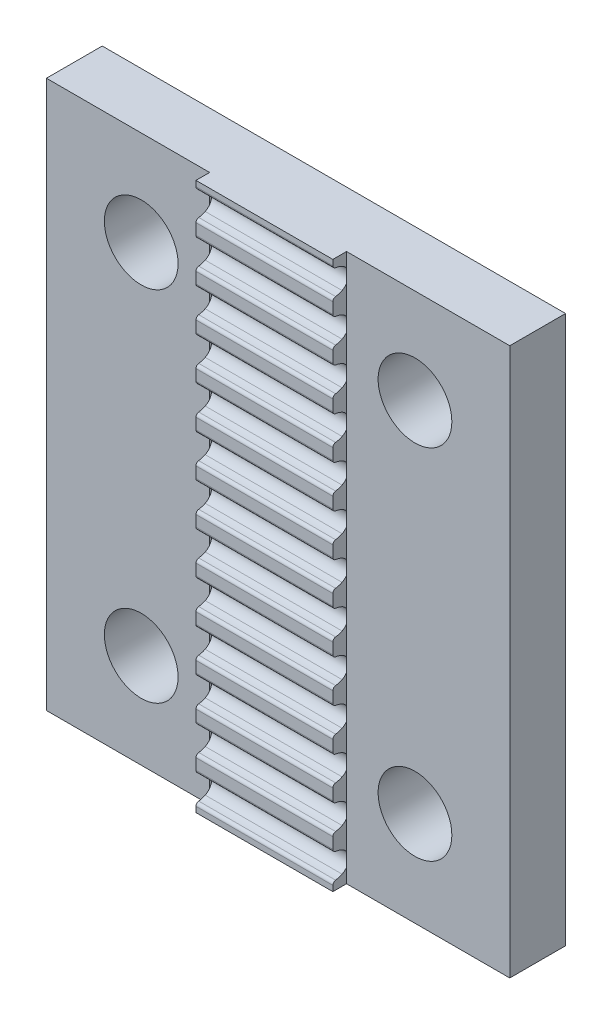
from build123d import *

# Parameters (mm, degrees)
SCHIZZO1_W                   = 7.75
SCHIZZO1_H                   = 26
SCHIZZO1_R                   = 1.75
SCHIZZO1_W_2                 = 6.5
ESTRUSIONE_ESTRUSIONE1_DEPTH = 1
SCHIZZO1_3_W                 = 6.5
SCHIZZO1_3_H                 = 26
ESTRUSIONE_ESTRUSIONE2_DEPTH = 1.65
ESTRUSIONE_ESTRUSIONE3_START = -1.65
SCHIZZO1_5_W                 = 7.75
SCHIZZO1_5_H                 = 26
SCHIZZO1_5_R                 = 1.75
SCHIZZO1_5_W_2               = 6.5
ESTRUSIONE_ESTRUSIONE3_DEPTH = 1.65
TAGLIO_ESTRUSIONE1_DEPTH     = 6.5


with BuildPart() as part:
    # Schizzo1 → Estrusione-Estrusione1 (new body)
    # profile 1 of 3: a face of its own
    with BuildSketch(Plane.XY):
        with Locations((-7.125, 0)):
            Rectangle(SCHIZZO1_W, SCHIZZO1_H)
        with Locations((-6.5, -8.5)):
            Circle(SCHIZZO1_R, mode=Mode.SUBTRACT)
        with Locations((-6.5, 8.5)):
            Circle(SCHIZZO1_R, mode=Mode.SUBTRACT)
    # profile 2 of 3: a face of its own
    with BuildSketch(Plane.XY):
        Rectangle(SCHIZZO1_W_2, SCHIZZO1_H)
    # profile 3 of 3: a face of its own
    with BuildSketch(Plane.XY):
        with Locations((7.125, 0)):
            Rectangle(SCHIZZO1_W, SCHIZZO1_H)
        with Locations((6.5, -8.5)):
            Circle(SCHIZZO1_R, mode=Mode.SUBTRACT)
        with Locations((6.5, 8.5)):
            Circle(SCHIZZO1_R, mode=Mode.SUBTRACT)
    extrude(amount=ESTRUSIONE_ESTRUSIONE1_DEPTH)

    # Schizzo1<3> → Estrusione-Estrusione2 (add)
    with BuildSketch(Plane.XY):
        Rectangle(SCHIZZO1_3_W, SCHIZZO1_3_H)
    extrude(amount=ESTRUSIONE_ESTRUSIONE2_DEPTH)

    # Schizzo1<5> → Estrusione-Estrusione3 (add)
    # profile 1 of 3: a face of its own
    with BuildSketch(Plane.XY.offset(ESTRUSIONE_ESTRUSIONE3_START)):
        with Locations((-7.125, 0)):
            Rectangle(SCHIZZO1_5_W, SCHIZZO1_5_H)
        with Locations((-6.5, -8.5)):
            Circle(SCHIZZO1_5_R, mode=Mode.SUBTRACT)
        with Locations((-6.5, 8.5)):
            Circle(SCHIZZO1_5_R, mode=Mode.SUBTRACT)
    # profile 2 of 3: a face of its own
    with BuildSketch(Plane.XY.offset(ESTRUSIONE_ESTRUSIONE3_START)):
        Rectangle(SCHIZZO1_5_W_2, SCHIZZO1_5_H)
    # profile 3 of 3: a face of its own
    with BuildSketch(Plane.XY.offset(ESTRUSIONE_ESTRUSIONE3_START)):
        with Locations((7.125, 0)):
            Rectangle(SCHIZZO1_5_W, SCHIZZO1_5_H)
        with Locations((6.5, -8.5)):
            Circle(SCHIZZO1_5_R, mode=Mode.SUBTRACT)
        with Locations((6.5, 8.5)):
            Circle(SCHIZZO1_5_R, mode=Mode.SUBTRACT)
    extrude(amount=ESTRUSIONE_ESTRUSIONE3_DEPTH)

    # Schizzo2 → Taglio-Estrusione1 (cut)
    with BuildSketch(Plane.ZY.offset(3.25)):
        with BuildLine():
            Line((1.65, 13), (1.65, 12.740175425))
            ThreePointArc((1.65, 12.740175425), (1.612771412, 12.641268354), (1.519565217, 12.591456891))
            ThreePointArc((1.519565217, 12.591456891), (1.361937846, 12.557611714), (1.211797753, 12.498876404))
            ThreePointArc((1.211797753, 12.498876404), (0.9, 12), (1.211797753, 11.501123596))
            ThreePointArc((1.211797753, 11.501123596), (1.361937846, 11.442388286), (1.519565217, 11.408543109))
            ThreePointArc((1.519565217, 11.408543109), (1.612771412, 11.358731646), (1.65, 11.259824575))
            Line((1.65, 11.259824575), (1.65, 11))
            Line((1.65, 11), (1.65, 10.740175425))
            ThreePointArc((1.65, 10.740175425), (1.612771412, 10.641268354), (1.519565217, 10.591456891))
            ThreePointArc((1.519565217, 10.591456891), (1.361937846, 10.557611714), (1.211797753, 10.498876404))
            ThreePointArc((1.211797753, 10.498876404), (0.9, 10), (1.211797753, 9.501123596))
            ThreePointArc((1.211797753, 9.501123596), (1.361937846, 9.442388286), (1.519565217, 9.408543109))
            ThreePointArc((1.519565217, 9.408543109), (1.612771412, 9.358731646), (1.65, 9.259824575))
            Line((1.65, 9.259824575), (1.65, 9))
            Line((1.65, 9), (1.65, 8.740175425))
            ThreePointArc((1.65, 8.740175425), (1.612771412, 8.641268354), (1.519565217, 8.591456891))
            ThreePointArc((1.519565217, 8.591456891), (1.361937846, 8.557611714), (1.211797753, 8.498876404))
            ThreePointArc((1.211797753, 8.498876404), (0.9, 8), (1.211797753, 7.501123596))
            ThreePointArc((1.211797753, 7.501123596), (1.361937846, 7.442388286), (1.519565217, 7.408543109))
            ThreePointArc((1.519565217, 7.408543109), (1.612771412, 7.358731646), (1.65, 7.259824575))
            Line((1.65, 7.259824575), (1.65, 7))
            Line((1.65, 7), (1.65, 6.740175425))
            ThreePointArc((1.65, 6.740175425), (1.612771412, 6.641268354), (1.519565217, 6.591456891))
            ThreePointArc((1.519565217, 6.591456891), (1.361937846, 6.557611714), (1.211797753, 6.498876404))
            ThreePointArc((1.211797753, 6.498876404), (0.9, 6), (1.211797753, 5.501123596))
            ThreePointArc((1.211797753, 5.501123596), (1.361937846, 5.442388286), (1.519565217, 5.408543109))
            ThreePointArc((1.519565217, 5.408543109), (1.612771412, 5.358731646), (1.65, 5.259824575))
            Line((1.65, 5.259824575), (1.65, 5))
            Line((1.65, 5), (1.65, 4.740175425))
            ThreePointArc((1.65, 4.740175425), (1.612771412, 4.641268354), (1.519565217, 4.591456891))
            ThreePointArc((1.519565217, 4.591456891), (1.361937846, 4.557611714), (1.211797753, 4.498876404))
            ThreePointArc((1.211797753, 4.498876404), (0.9, 4), (1.211797753, 3.501123596))
            ThreePointArc((1.211797753, 3.501123596), (1.361937846, 3.442388286), (1.519565217, 3.408543109))
            ThreePointArc((1.519565217, 3.408543109), (1.612771412, 3.358731646), (1.65, 3.259824575))
            Line((1.65, 3.259824575), (1.65, 3))
            Line((1.65, 3), (1.65, 2.740175425))
            ThreePointArc((1.65, 2.740175425), (1.612771412, 2.641268354), (1.519565217, 2.591456891))
            ThreePointArc((1.519565217, 2.591456891), (1.361937846, 2.557611714), (1.211797753, 2.498876404))
            ThreePointArc((1.211797753, 2.498876404), (0.9, 2), (1.211797753, 1.501123596))
            ThreePointArc((1.211797753, 1.501123596), (1.361937846, 1.442388286), (1.519565217, 1.408543109))
            ThreePointArc((1.519565217, 1.408543109), (1.612771412, 1.358731646), (1.65, 1.259824575))
            Line((1.65, 1.259824575), (1.65, 1))
            Line((1.65, 1), (1.65, 0.740175425))
            ThreePointArc((1.65, 0.740175425), (1.612771412, 0.641268354), (1.519565217, 0.591456891))
            ThreePointArc((1.519565217, 0.591456891), (1.361937846, 0.557611714), (1.211797753, 0.498876404))
            ThreePointArc((1.211797753, 0.498876404), (0.9, 0), (1.211797753, -0.498876404))
            ThreePointArc((1.211797753, -0.498876404), (1.361937846, -0.557611714), (1.519565217, -0.591456891))
            ThreePointArc((1.519565217, -0.591456891), (1.612771412, -0.641268354), (1.65, -0.740175425))
            Line((1.65, -0.740175425), (1.65, -1))
            Line((1.65, -1), (1.65, -1.259824575))
            ThreePointArc((1.65, -1.259824575), (1.612771412, -1.358731646), (1.519565217, -1.408543109))
            ThreePointArc((1.519565217, -1.408543109), (1.361937846, -1.442388286), (1.211797753, -1.501123596))
            ThreePointArc((1.211797753, -1.501123596), (0.9, -2), (1.211797753, -2.498876404))
            ThreePointArc((1.211797753, -2.498876404), (1.361937846, -2.557611714), (1.519565217, -2.591456891))
            ThreePointArc((1.519565217, -2.591456891), (1.612771412, -2.641268354), (1.65, -2.740175425))
            Line((1.65, -2.740175425), (1.65, -3))
            Line((1.65, -3), (1.65, -3.259824575))
            ThreePointArc((1.65, -3.259824575), (1.612771412, -3.358731646), (1.519565217, -3.408543109))
            ThreePointArc((1.519565217, -3.408543109), (1.361937846, -3.442388286), (1.211797753, -3.501123596))
            ThreePointArc((1.211797753, -3.501123596), (0.9, -4), (1.211797753, -4.498876404))
            ThreePointArc((1.211797753, -4.498876404), (1.361937846, -4.557611714), (1.519565217, -4.591456891))
            ThreePointArc((1.519565217, -4.591456891), (1.612771412, -4.641268354), (1.65, -4.740175425))
            Line((1.65, -4.740175425), (1.65, -5))
            Line((1.65, -5), (1.65, -5.259824575))
            ThreePointArc((1.65, -5.259824575), (1.612771412, -5.358731646), (1.519565217, -5.408543109))
            ThreePointArc((1.519565217, -5.408543109), (1.361937846, -5.442388286), (1.211797753, -5.501123596))
            ThreePointArc((1.211797753, -5.501123596), (0.9, -6), (1.211797753, -6.498876404))
            ThreePointArc((1.211797753, -6.498876404), (1.361937846, -6.557611714), (1.519565217, -6.591456891))
            ThreePointArc((1.519565217, -6.591456891), (1.612771412, -6.641268354), (1.65, -6.740175425))
            Line((1.65, -6.740175425), (1.65, -7))
            Line((1.65, -7), (1.65, -7.259824575))
            ThreePointArc((1.65, -7.259824575), (1.612771412, -7.358731646), (1.519565217, -7.408543109))
            ThreePointArc((1.519565217, -7.408543109), (1.361937846, -7.442388286), (1.211797753, -7.501123596))
            ThreePointArc((1.211797753, -7.501123596), (0.9, -8), (1.211797753, -8.498876404))
            ThreePointArc((1.211797753, -8.498876404), (1.361937846, -8.557611714), (1.519565217, -8.591456891))
            ThreePointArc((1.519565217, -8.591456891), (1.612771412, -8.641268354), (1.65, -8.740175425))
            Line((1.65, -8.740175425), (1.65, -9))
            Line((1.65, -9), (1.65, -9.259824575))
            ThreePointArc((1.65, -9.259824575), (1.612771412, -9.358731646), (1.519565217, -9.408543109))
            ThreePointArc((1.519565217, -9.408543109), (1.361937846, -9.442388286), (1.211797753, -9.501123596))
            ThreePointArc((1.211797753, -9.501123596), (0.9, -10), (1.211797753, -10.498876404))
            ThreePointArc((1.211797753, -10.498876404), (1.361937846, -10.557611714), (1.519565217, -10.591456891))
            ThreePointArc((1.519565217, -10.591456891), (1.612771412, -10.641268354), (1.65, -10.740175425))
            Line((1.65, -10.740175425), (1.65, -11))
            Line((1.65, -11), (1.65, -11.259824575))
            ThreePointArc((1.65, -11.259824575), (1.612771412, -11.358731646), (1.519565217, -11.408543109))
            ThreePointArc((1.519565217, -11.408543109), (1.361937846, -11.442388286), (1.211797753, -11.501123596))
            ThreePointArc((1.211797753, -11.501123596), (0.9, -12), (1.211797753, -12.498876404))
            ThreePointArc((1.211797753, -12.498876404), (1.361937846, -12.557611714), (1.519565217, -12.591456891))
            ThreePointArc((1.519565217, -12.591456891), (1.612771412, -12.641268354), (1.65, -12.740175425))
            Line((1.65, -12.740175425), (1.65, -13))
            Line((1.65, -13), (2.28, -13))
            Line((2.28, -13), (2.28, -11))
            Line((2.28, -11), (2.28, -9))
            Line((2.28, -9), (2.28, -7))
            Line((2.28, -7), (2.28, -5))
            Line((2.28, -5), (2.28, -3))
            Line((2.28, -3), (2.28, -1))
            Line((2.28, -1), (2.28, 1))
            Line((2.28, 1), (2.28, 3))
            Line((2.28, 3), (2.28, 5))
            Line((2.28, 5), (2.28, 7))
            Line((2.28, 7), (2.28, 9))
            Line((2.28, 9), (2.28, 11))
            Line((2.28, 11), (2.28, 13))
            Line((2.28, 13), (1.65, 13))
        make_face()
    extrude(amount=-TAGLIO_ESTRUSIONE1_DEPTH, mode=Mode.SUBTRACT)


solid = part.part
